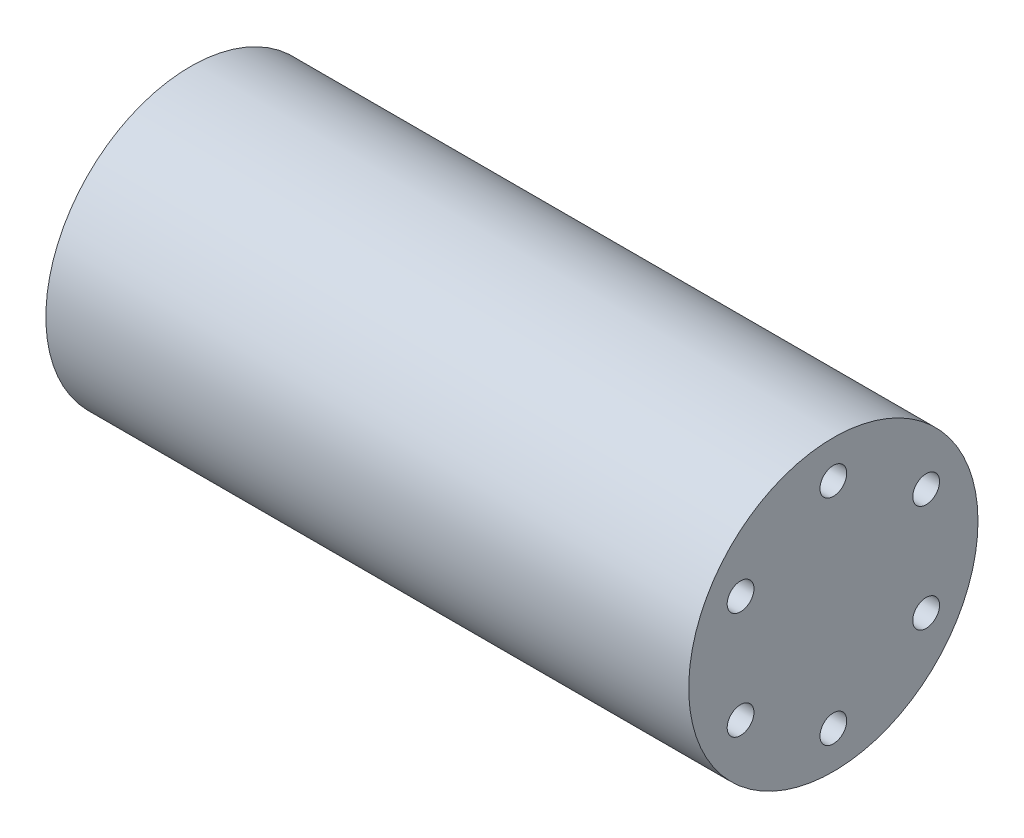
from build123d import *

# Parameters (mm, degrees)
SKETCH1_R           = 13.5
BOSS_EXTRUDE1_DEPTH = 30
SKETCH2_R           = 1.25
CUT_EXTRUDE1_DEPTH  = 4


with BuildPart() as part:
    # Sketch1 → Boss-Extrude1 (new, symmetric)
    with BuildSketch(Plane(origin=(0, 0, 0), x_dir=(0, 0, -1), z_dir=(1, 0, 0))):
        Circle(SKETCH1_R)
    extrude(amount=BOSS_EXTRUDE1_DEPTH, both=True)

    # Sketch2 → Cut-Extrude1 (cut)
    with BuildSketch(Plane.ZY.offset(30)):
        with Locations((0, 10)):
            Circle(SKETCH2_R)
        with Locations((8.660254038, 5)):
            Circle(SKETCH2_R)
        with Locations((8.660254038, -5)):
            Circle(SKETCH2_R)
        with Locations((0, -10)):
            Circle(SKETCH2_R)
        with Locations((-8.660254038, -5)):
            Circle(SKETCH2_R)
        with Locations((-8.660254038, 5)):
            Circle(SKETCH2_R)
    cut_extrude1 = extrude(amount=-CUT_EXTRUDE1_DEPTH, mode=Mode.SUBTRACT)

    # Mirror1: Cut-Extrude1 across plane
    add(cut_extrude1.mirror(Plane(origin=(0, 0, 0), x_dir=(0, 0, 1), z_dir=(1, 0, 0))), mode=Mode.SUBTRACT)


solid = part.part
